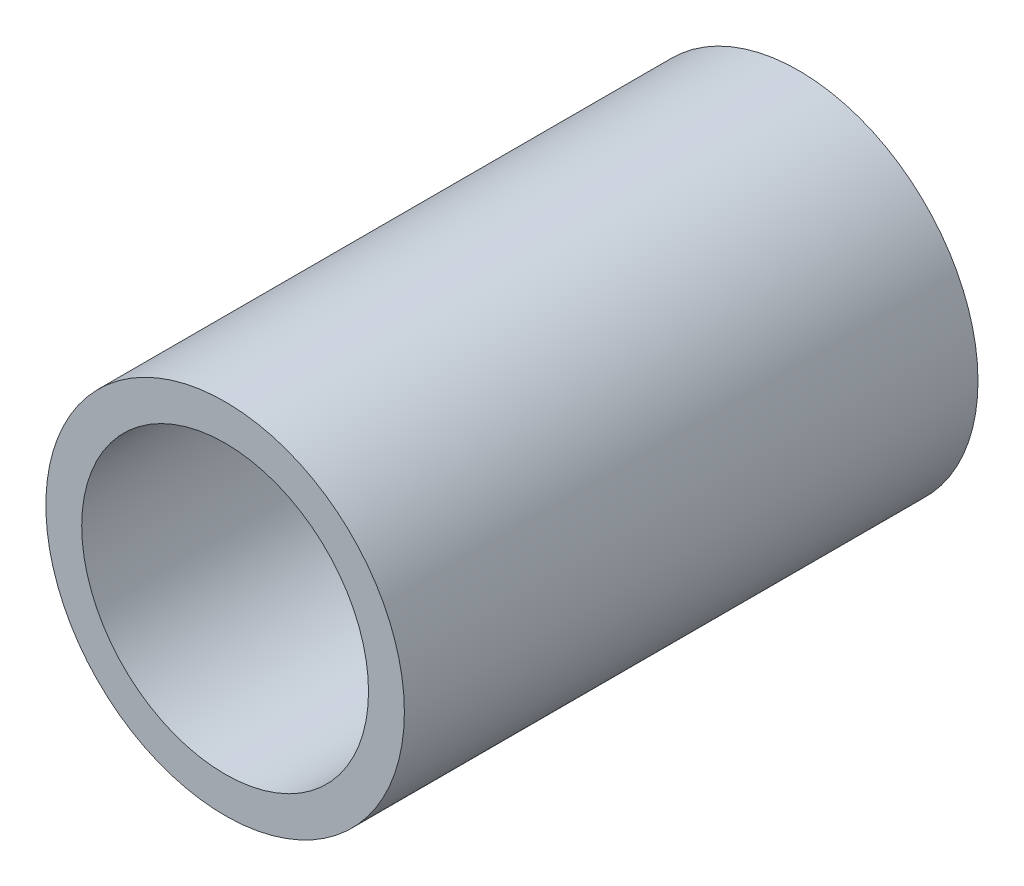
from build123d import *

# Parameters (mm, degrees)
SKETCH2_R           = 1.984375
BOSS_EXTRUDE3_DEPTH = 6.35
SKETCH3_R           = 1.5875
CUT_EXTRUDE1_DEPTH  = 7.9424771


with BuildPart() as part:
    # Sketch2 → Boss-Extrude3 (new body)
    with BuildSketch(Plane.XY):
        Circle(SKETCH2_R)
    extrude(amount=BOSS_EXTRUDE3_DEPTH)

    # Sketch3 → Cut-Extrude1 (cut, through all)
    with BuildSketch(Plane.XY.offset(6.35)):
        Circle(SKETCH3_R)
    extrude(amount=-CUT_EXTRUDE1_DEPTH, mode=Mode.SUBTRACT)


solid = part.part
